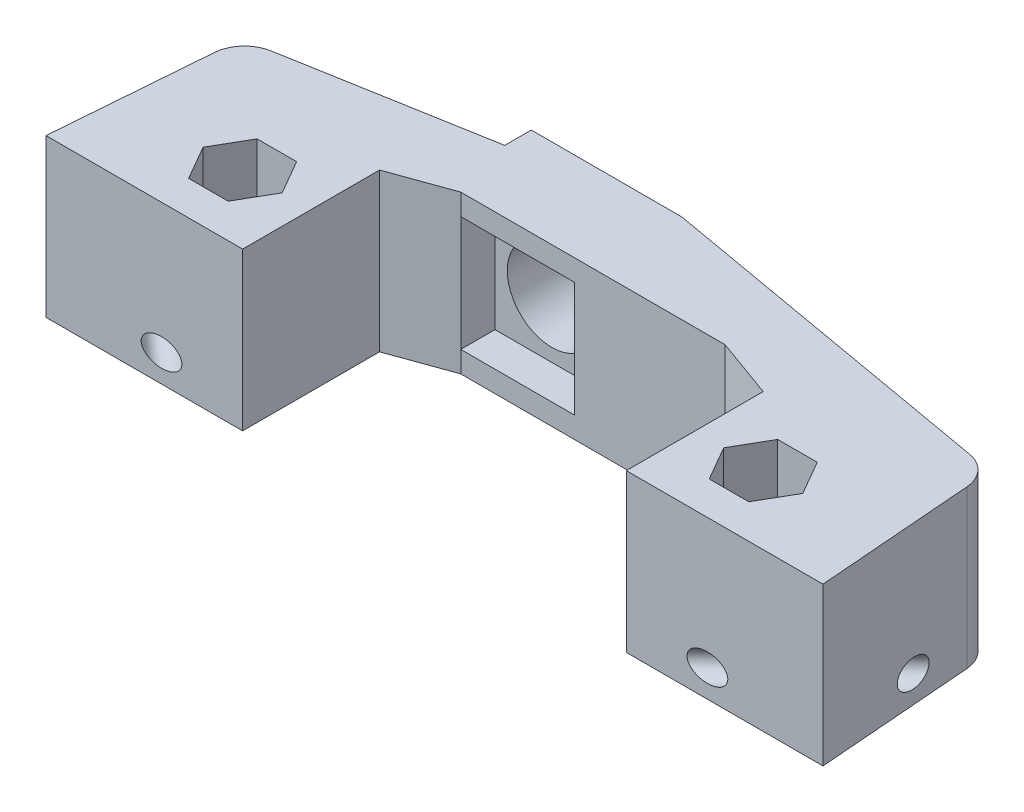
from build123d import *

# Parameters (mm, degrees)
SKETCH1_W           = 10
SKETCH1_H           = 10
BOSS_EXTRUDE1_DEPTH = 11.5
CUT_EXTRUDE1_REACH  = 37.548
SKETCH2_R           = 3.25
SKETCH3_W           = 8.3
SKETCH3_H           = 1.55
BOSS_EXTRUDE2_DEPTH = 2.5
CUT_EXTRUDE2_REACH  = 55.761
SKETCH4_R           = 1


with BuildPart() as part:
    # Sketch1 → Boss-Extrude1 (new body)
    # profile 1 of 4: a face of its own
    with BuildSketch(Plane(origin=(0, 0, 0), x_dir=(1, 0, 0), z_dir=(0, 1, 0))):
        with BuildLine():
            Line((-27.472148501, 6.754381863), (-28.370678518, -4.662524505))
            Line((-28.370678518, -4.662524505), (-24.01063487, -4.662524505))
            Line((-24.01063487, -4.662524505), (-24.01063487, 5.337475495))
            Line((-24.01063487, 5.337475495), (-14.01063487, 5.337475495))
            Line((-14.01063487, 5.337475495), (-9.65, 6.907286969))
            Line((-9.65, 6.907286969), (-9.65, 9.407286969))
            Line((-9.65, 9.407286969), (-1.35, 9.407286969))
            Line((-1.35, 9.407286969), (-1.35, 6.907286969))
            Line((-1.35, 6.907286969), (9.65, 6.907286969))
            Line((9.65, 6.907286969), (14.01063487, 5.337475495))
            Line((14.01063487, 5.337475495), (24.01063487, 5.337475495))
            Line((24.01063487, 5.337475495), (24.01063487, -4.662524505))
            Line((24.01063487, -4.662524505), (28.370678518, -4.662524505))
            Line((28.370678518, -4.662524505), (27.472148501, 6.754381863))
            ThreePointArc((27.472148501, 6.754381863), (26.86214664, 8.165702195), (25.515789835, 8.908164787))
            Line((25.515789835, 8.908164787), (0, 13.407286969))
            Line((0, 13.407286969), (-11, 11.467690181))
            Line((-11, 11.467690181), (-25.515789835, 8.908164787))
            ThreePointArc((-25.515789835, 8.908164787), (-26.86214664, 8.165702195), (-27.472148501, 6.754381863))
        make_face()
    # profile 2 of 4: a face of its own
    with BuildSketch(Plane(origin=(0, 0, 0), x_dir=(1, 0, 0), z_dir=(0, 1, 0))):
        with Locations((-19.01063487, 0.337475495)):
            Rectangle(SKETCH1_W, SKETCH1_H)
        Polygon((-17.567259197, 2.837475495), (-16.123883525, 0.337475495), (-17.567259197, -2.162524505), (-20.454010543, -2.162524505), (-21.897386216, 0.337475495), (-20.454010543, 2.837475495), align=None, mode=Mode.SUBTRACT)
    # profile 3 of 4: a face of its own
    with BuildSketch(Plane(origin=(0, 0, 0), x_dir=(1, 0, 0), z_dir=(0, 1, 0))):
        Polygon((-11, 13.407286969), (-11, 11.467690181), (0, 13.407286969), align=None)
    # profile 4 of 4: a face of its own
    with BuildSketch(Plane(origin=(0, 0, 0), x_dir=(1, 0, 0), z_dir=(0, 1, 0))):
        with Locations((19.01063487, 0.337475495)):
            Rectangle(SKETCH1_W, SKETCH1_H)
        Polygon((20.454010543, 2.837475495), (21.897386216, 0.337475495), (20.454010543, -2.162524505), (17.567259197, -2.162524505), (16.123883525, 0.337475495), (17.567259197, 2.837475495), align=None, mode=Mode.SUBTRACT)
    extrude(amount=BOSS_EXTRUDE1_DEPTH)

    # Sketch2 → Cut-Extrude1 (cut, up to next)
    with BuildSketch(Plane(origin=(0, 0, -13.407286969), x_dir=(-1, 0, 0), z_dir=(0, 0, -1)), mode=Mode.PRIVATE) as cut_extrude1_sk1:
        with Locations((5.5, 5.75)):
            Circle(SKETCH2_R)
    cut_extrude1_tool1 = extrude(cut_extrude1_sk1.sketch, amount=-CUT_EXTRUDE1_REACH, mode=Mode.PRIVATE) & part.part
    add(cut_extrude1_tool1.solids().sort_by_distance((-5.5, 5.75, -13.407287))[0], mode=Mode.SUBTRACT)

    # Sketch3 → Boss-Extrude2 (add)
    with BuildSketch(Plane.XY.offset(-9.407286969)):
        with Locations((-5.5, 10.725)):
            Rectangle(SKETCH3_W, SKETCH3_H)
        with Locations((-5.5, 0.775)):
            Rectangle(SKETCH3_W, SKETCH3_H)
    extrude(amount=BOSS_EXTRUDE2_DEPTH)

    # Cut-Extrude2: up to this plane
    cut_extrude2_end = Plane(origin=(0, 11.5, 4.662524505), z_dir=(0, 0, -1))
    # Sketch4 → Cut-Extrude2 (cut, up to the surface)
    with BuildSketch(Plane(origin=(19.248080096, 0, -17.483724977), x_dir=(-0.6723668074346677, 0, -0.7402181274868325), z_dir=(0.7402181274868325, 0, -0.6723668074346677)), mode=Mode.PRIVATE) as cut_extrude2_sk1:
        with Locations((-16.853337608, 2)):
            Circle(SKETCH4_R)
    cut_extrude2_tool1 = split(extrude(cut_extrude2_sk1.sketch, amount=-CUT_EXTRUDE2_REACH, mode=Mode.PRIVATE), bisect_by=cut_extrude2_end, keep=Keep.BOTH, mode=Mode.PRIVATE)
    cut_extrude2 = cut_extrude2_tool1.solids().sort_by_distance((30.579705, 2, -5.008579))[0]
    add(cut_extrude2, mode=Mode.SUBTRACT)

    # Mirror1: Cut-Extrude2 across plane
    add(cut_extrude2.mirror(Plane(origin=(0, 0, 0), x_dir=(0, 0, 1), z_dir=(1, 0, 0))), mode=Mode.SUBTRACT)


solid = part.part
